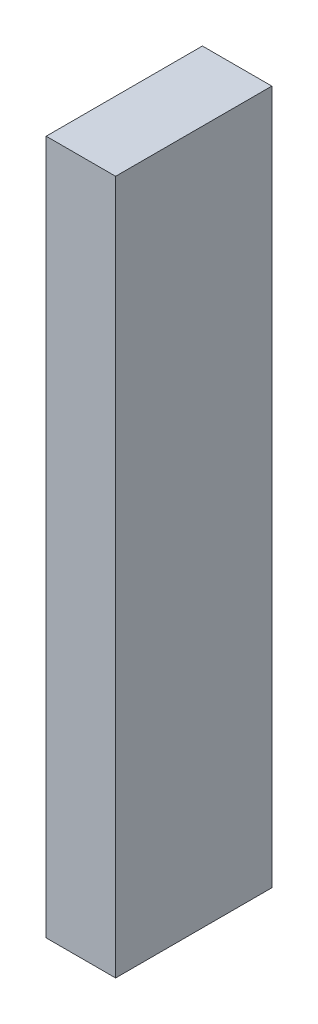
from build123d import *

# Parameters (mm, degrees)
SKETCH1_W           = 20
SKETCH1_H           = 45
BOSS_EXTRUDE1_DEPTH = 200


with BuildPart() as part:
    # Sketch1 → Boss-Extrude1 (new body)
    with BuildSketch(Plane(origin=(0, 0, 0), x_dir=(1, 0, 0), z_dir=(0, 1, 0))):
        with Locations((-10, 22.5)):
            Rectangle(SKETCH1_W, SKETCH1_H)
    extrude(amount=BOSS_EXTRUDE1_DEPTH)


solid = part.part
